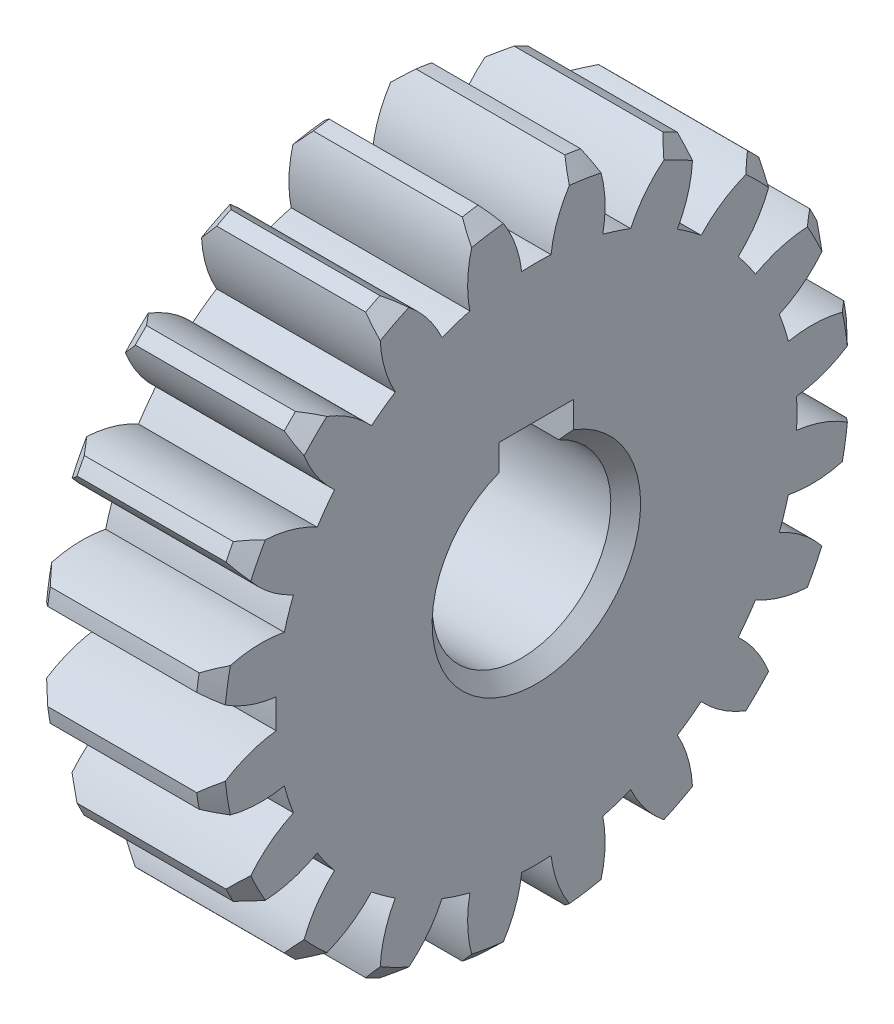
from build123d import *

# Parameters (mm, degrees)
BASPROSKE_W     = 12
BASPROSKE_H     = 22
TOOTHCUT_DEPTH  = 34.346664001
TEETHCUTS_COUNT = 20
TEETHCUTS_ANGLE = 342
BORSKE_R        = 6
BORE_DEPTH      = 50.0000508
KEYSKE_W        = 5
KEYSKE_H        = 8.3
KEYWAY_DEPTH    = 50.0000508
CHAMFER1_SIZE   = 1


with BuildPart() as part:
    # BasProSke → Base-Revolve (revolve)
    with BuildSketch(Plane(origin=(0, 0, 0), x_dir=(1, 0, 0), z_dir=(0, 1, 0)), mode=Mode.PRIVATE) as base_revolve_sk:
        with Locations((6, 11)):
            Rectangle(BASPROSKE_W, BASPROSKE_H)
    revolve(base_revolve_sk.sketch.rotate(Axis((-10, 0, 0), (1, 0, 0)), 180), axis=Axis((-10, 0, 0), (1, 0, 0)))

    # TooCutSke → ToothCut (cut, through all)
    with BuildSketch(Plane(origin=(0, 0, 0), x_dir=(0, 0, -1), z_dir=(1, 0, 0))):
        with BuildLine():
            ThreePointArc((0.986171591, 17.471189616), (0, 17.499), (-0.986171591, 17.471189616))
            ThreePointArc((-0.986171591, 17.471189616), (-1.626916196, 19.798789858), (-2.932850173, 21.829260982))
            ThreePointArc((-2.932850173, 21.829260982), (0, 22.0254), (2.932850173, 21.829260982))
            ThreePointArc((2.932850173, 21.829260982), (1.626916196, 19.798789858), (0.986171591, 17.471189616))
        make_face()
    toothcut = extrude(amount=TOOTHCUT_DEPTH, mode=Mode.SUBTRACT)

    # TeethCuts: ToothCut ×20 about axis
    teethcuts_axis = Axis((-10, 0, 0), (1, 0, 0))
    for i in range(1, TEETHCUTS_COUNT):
        add(toothcut.rotate(teethcuts_axis, i * TEETHCUTS_ANGLE / (TEETHCUTS_COUNT - 1)), mode=Mode.SUBTRACT)

    # BorSke → Bore (cut, symmetric)
    with BuildSketch(Plane(origin=(0, 0, 0), x_dir=(0, 0, -1), z_dir=(1, 0, 0))):
        with Locations(Location((0, 0, 0), (0, 0, 180))):
            Circle(BORSKE_R)
    extrude(amount=BORE_DEPTH, both=True, mode=Mode.SUBTRACT)

    # KeySke → Keyway (cut, symmetric)
    with BuildSketch(Plane(origin=(0, 0, 0), x_dir=(0, 0, -1), z_dir=(1, 0, 0))):
        with Locations((0, 4.15)):
            Rectangle(KEYSKE_W, KEYSKE_H)
    extrude(amount=KEYWAY_DEPTH, both=True, mode=Mode.SUBTRACT)

    # Chamfer1
    chamfer1_edges = [part.edges().sort_by_distance(p)[0] for p in [
        (12, 21.729143493, -3.441558231),
        (0, 21.729143493, 3.441558231),
        (12, 21.729143493, 3.441558231),
        (0, -6, 0),
        (12, -6, 0),
        (0, 19.602143532, -9.987790994),
        (0, 15.556349186, -15.556349186),
        (0, 9.987790994, -19.602143532),
        (0, 3.441558231, -21.729143493),
        (0, -3.441558231, -21.729143493),
        (0, -9.987790994, -19.602143532),
        (0, -15.556349186, -15.556349186),
        (0, -19.602143532, -9.987790994),
        (0, -21.729143493, -3.441558231),
        (0, -21.729143493, 3.441558231),
        (0, -19.602143532, 9.987790994),
        (0, -15.556349186, 15.556349186),
        (0, -9.987790994, 19.602143532),
        (0, -3.441558231, 21.729143493),
        (0, 3.441558231, 21.729143493),
        (0, 9.987790994, 19.602143532),
        (0, 15.556349186, 15.556349186),
        (0, 19.602143532, 9.987790994),
        (12, 19.602143532, -9.987790994),
        (12, 15.556349186, -15.556349186),
        (12, 9.987790994, -19.602143532),
        (12, 3.441558231, -21.729143493),
        (12, -3.441558231, -21.729143493),
        (12, -9.987790994, -19.602143532),
        (12, -15.556349186, -15.556349186),
        (12, -19.602143532, -9.987790994),
        (12, -21.729143493, -3.441558231),
        (12, -21.729143493, 3.441558231),
        (12, -19.602143532, 9.987790994),
        (12, -15.556349186, 15.556349186),
        (12, -9.987790994, 19.602143532),
        (12, -3.441558231, 21.729143493),
        (0, 21.729143493, -3.441558231),
        (12, 3.441558231, 21.729143493),
        (12, 9.987790994, 19.602143532),
        (12, 15.556349186, 15.556349186),
        (12, 19.602143532, 9.987790994),
    ]]
    chamfer(chamfer1_edges, length=CHAMFER1_SIZE)


solid = part.part
